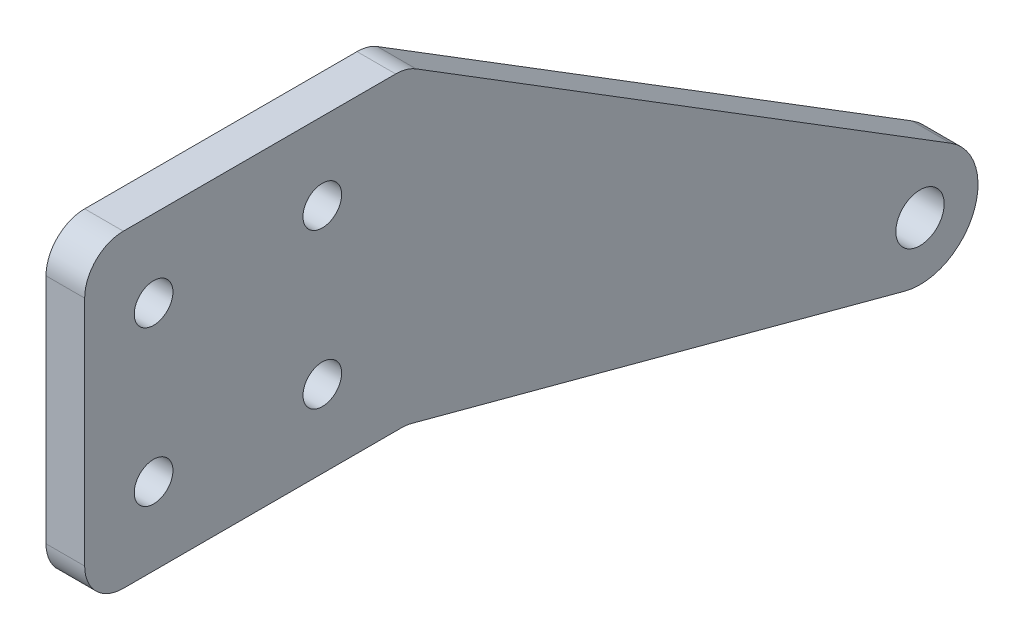
from build123d import *

# Parameters (mm, degrees)
BOSS_EXTRUDE1_START = -38.1
SKETCH1_R           = 3.968749999
SKETCH1_R_2         = 3.175
SKETCH1_R_3         = 3.174999999
BOSS_EXTRUDE1_DEPTH = 6.35
FILLET1_R           = 6.35


with BuildPart() as part:
    # Sketch1 → Boss-Extrude1 (new body)
    with BuildSketch(Plane(origin=(0, 0, 0), x_dir=(0, 0, -1), z_dir=(1, 0, 0)).offset(BOSS_EXTRUDE1_START)):
        with BuildLine():
            Line((23.324046982, 737.356140976), (23.324046982, 788.156140976))
            Line((23.324046982, 788.156140976), (76.2, 788.156140976))
            Line((76.2, 788.156140976), (165.505551403, 732.749973094))
            ThreePointArc((165.505551403, 732.749973094), (169.225626516, 720.873230423), (158.021191738, 715.455055766))
            Line((158.021191738, 715.455055766), (76.2, 737.356140976))
            Line((76.2, 737.356140976), (23.324046982, 737.356140976))
        make_face()
        with Locations((160.484046982, 724.656140976)):
            Circle(SKETCH1_R, mode=Mode.SUBTRACT)
        with Locations((62.346011746, 750.056140976)):
            Circle(SKETCH1_R_2, mode=Mode.SUBTRACT)
        with Locations((34.638035237, 750.056140976)):
            Circle(SKETCH1_R_3, mode=Mode.SUBTRACT)
        with Locations((34.638035237, 775.456140976)):
            Circle(SKETCH1_R_3, mode=Mode.SUBTRACT)
        with Locations((62.346011746, 775.456140976)):
            Circle(SKETCH1_R_2, mode=Mode.SUBTRACT)
    extrude(amount=-BOSS_EXTRUDE1_DEPTH)

    # Fillet1
    fillet1_edges = [part.edges().sort_by_distance(p)[0] for p in [
        (-41.275, 788.156140976, -76.2),
        (-41.275, 788.156140976, -23.324046982),
        (-41.275, 737.356140976, -23.324046982),
        (-41.275, 737.356140976, -76.2),
    ]]
    fillet(fillet1_edges, radius=FILLET1_R)


solid = part.part
